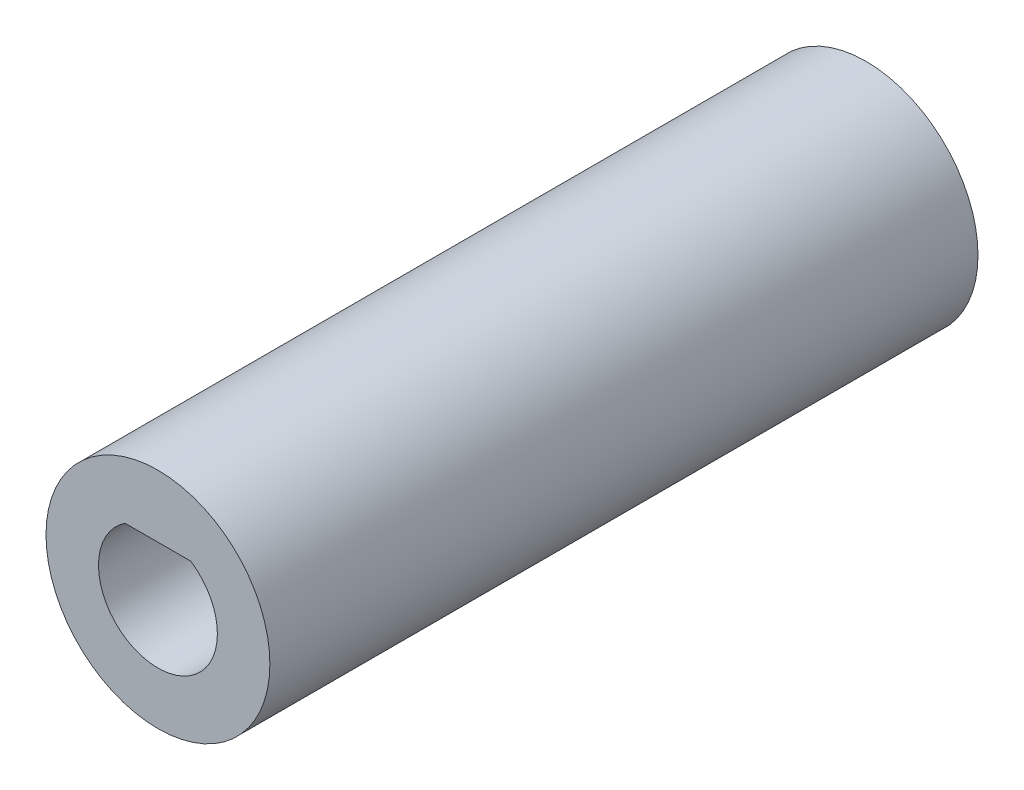
from build123d import *

# Parameters (mm, degrees)
SKETCH1_R           = 5.65
BOSS_EXTRUDE1_DEPTH = 7
SKETCH2_R           = 5.65
BOSS_EXTRUDE2_DEPTH = 14.74
SKETCH3_R           = 5.65
BOSS_EXTRUDE3_DEPTH = 14


with BuildPart() as part:
    # Sketch1 → Boss-Extrude1 (new body)
    # profile 1 of 12: a face of its own
    with BuildSketch(Plane.XY):
        Circle(SKETCH1_R)
        with BuildLine():
            ThreePointArc((-0.81964124, -3.557591308), (-1.028546403, -3.50290736), (-1.233852984, -3.435967766))
            ThreePointArc((-1.233852984, -3.435967766), (-1.973766094, -3.071239991), (-2.612905161, -2.549704746))
            ThreePointArc((-2.612905161, -2.549704746), (-2.759082994, -2.390759024), (-2.895607604, -2.223448736))
            ThreePointArc((-2.895607604, -2.223448736), (-3.320875399, -1.516592978), (-3.576590156, -0.732304943))
            ThreePointArc((-3.576590156, -0.732304943), (-3.613630229, -0.519561589), (-3.638027269, -0.305000442))
            ThreePointArc((-3.638027269, -0.305000442), (-3.613630229, 0.519561589), (-3.404733048, 1.317596505))
            ThreePointArc((-3.404733048, 1.317596505), (-3.320875399, 1.516592978), (-3.225398981, 1.710283337))
            ThreePointArc((-3.225398981, 1.710283337), (-2.759082994, 2.390759024), (-2.151897253, 2.949170373))
            ThreePointArc((-2.151897253, 2.949170373), (-1.973766094, 3.071239991), (-1.788729306, 3.182564241))
            ThreePointArc((-1.788729306, 3.182564241), (-1.028546403, 3.50290736), (-0.215849285, 3.644403485))
            ThreePointArc((-0.215849285, 3.644403485), (-0.107971873, 3.649193027), (0, 3.650790007))
            ThreePointArc((0, 3.650790007), (0.107971873, 3.649193027), (0.215849285, 3.644403485))
            ThreePointArc((0.215849285, 3.644403485), (1.028546403, 3.50290736), (1.788729306, 3.182564241))
            ThreePointArc((1.788729306, 3.182564241), (1.973766094, 3.071239991), (2.151897253, 2.949170373))
            ThreePointArc((2.151897253, 2.949170373), (2.759082994, 2.390759024), (3.225398981, 1.710283337))
            ThreePointArc((3.225398981, 1.710283337), (3.320875399, 1.516592978), (3.404733048, 1.317596505))
            ThreePointArc((3.404733048, 1.317596505), (3.588748603, 0.670187395), (3.650790007, 0))
            ThreePointArc((3.650790007, 0), (3.647597927, -0.152633677), (3.638027269, -0.305000442))
            ThreePointArc((3.638027269, -0.305000442), (3.613630229, -0.519561589), (3.576590156, -0.732304943))
            ThreePointArc((3.576590156, -0.732304943), (3.320875399, -1.516592978), (2.895607604, -2.223448736))
            ThreePointArc((2.895607604, -2.223448736), (2.759082994, -2.390759024), (2.612905161, -2.549704746))
            ThreePointArc((2.612905161, -2.549704746), (1.973766094, -3.071239991), (1.233852984, -3.435967766))
            ThreePointArc((1.233852984, -3.435967766), (1.028546403, -3.50290736), (0.81964124, -3.557591308))
            ThreePointArc((0.81964124, -3.557591308), (0, -3.650790007), (-0.81964124, -3.557591308))
        make_face(mode=Mode.SUBTRACT)
    # profile 2 of 12: a face of its own
    with BuildSketch(Plane.XY):
        with BuildLine():
            ThreePointArc((-2.151897253, 2.949170373), (-2.759082994, 2.390759024), (-3.225398981, 1.710283337))
            ThreePointArc((-3.225398981, 1.710283337), (-2.902782795, 1.721509121), (-2.585426091, 1.662416447))
            ThreePointArc((-2.585426091, 1.662416447), (-2.562741672, 1.6561643), (-2.539777266, 1.651035136))
            ThreePointArc((-2.539777266, 1.651035136), (-2.085465777, 1.807066382), (-1.99567797, 2.278959198))
            ThreePointArc((-1.99567797, 2.278959198), (-2.004023102, 2.300959902), (-2.013439941, 2.322523654))
            ThreePointArc((-2.013439941, 2.322523654), (-2.117095704, 2.628240359), (-2.151897253, 2.949170373))
        make_face()
    # profile 3 of 12: a face of its own
    with BuildSketch(Plane.XY):
        with BuildLine():
            ThreePointArc((-0.215849285, 3.644403485), (-1.028546403, 3.50290736), (-1.788729306, 3.182564241))
            ThreePointArc((-1.788729306, 3.182564241), (-1.511258183, 3.017588493), (-1.276228646, 2.796300584))
            ThreePointArc((-1.276228646, 2.796300584), (-1.260525464, 2.77877682), (-1.243979612, 2.762046398))
            ThreePointArc((-1.243979612, 2.762046398), (-0.777431606, 2.6476889), (-0.446772779, 2.996127445))
            ThreePointArc((-0.446772779, 2.996127445), (-0.441898672, 3.019147334), (-0.438162377, 3.042379044))
            ThreePointArc((-0.438162377, 3.042379044), (-0.360080224, 3.355604839), (-0.215849285, 3.644403485))
        make_face()
    # profile 4 of 12: a face of its own
    with BuildSketch(Plane.XY):
        with BuildLine():
            ThreePointArc((1.788729306, 3.182564241), (1.028546403, 3.50290736), (0.215849285, 3.644403485))
            ThreePointArc((0.215849285, 3.644403485), (0.360080224, 3.355604839), (0.438162377, 3.042379044))
            ThreePointArc((0.438162377, 3.042379044), (0.441898672, 3.019147334), (0.446772779, 2.996127445))
            ThreePointArc((0.446772779, 2.996127445), (0.777431606, 2.6476889), (1.243979612, 2.762046398))
            ThreePointArc((1.243979612, 2.762046398), (1.260525464, 2.77877682), (1.276228646, 2.796300584))
            ThreePointArc((1.276228646, 2.796300584), (1.511258183, 3.017588493), (1.788729306, 3.182564241))
        make_face()
    # profile 5 of 12: a face of its own
    with BuildSketch(Plane.XY):
        with BuildLine():
            ThreePointArc((2.585426091, 1.662416447), (2.902782795, 1.721509121), (3.225398981, 1.710283337))
            ThreePointArc((3.225398981, 1.710283337), (2.759082994, 2.390759024), (2.151897253, 2.949170373))
            ThreePointArc((2.151897253, 2.949170373), (2.117095704, 2.628240359), (2.013439941, 2.322523654))
            ThreePointArc((2.013439941, 2.322523654), (2.004023102, 2.300959902), (1.99567797, 2.278959198))
            ThreePointArc((1.99567797, 2.278959198), (2.085465777, 1.807066382), (2.539777266, 1.651035136))
            ThreePointArc((2.539777266, 1.651035136), (2.562741672, 1.6561643), (2.585426091, 1.662416447))
        make_face()
    # profile 6 of 12: a face of its own
    with BuildSketch(Plane.XY):
        with BuildLine():
            ThreePointArc((3.07376902, 0.000726834), (3.372694379, -0.121137234), (3.638027269, -0.305000442))
            ThreePointArc((3.638027269, -0.305000442), (3.647597927, -0.152633677), (3.650790007, 0))
            ThreePointArc((3.650790007, 0), (3.588748603, 0.670187395), (3.404733048, 1.317596505))
            ThreePointArc((3.404733048, 1.317596505), (3.201948257, 1.066428135), (2.94946455, 0.865283413))
            ThreePointArc((2.94946455, 0.865283413), (2.929884357, 0.852233959), (2.910969506, 0.838237507))
            ThreePointArc((2.910969506, 0.838237507), (2.731379298, 0.392713056), (3.029213584, 0.015831883))
            ThreePointArc((3.029213584, 0.015831883), (3.051305506, 0.007731316), (3.07376902, 0.000726834))
        make_face()
    # profile 7 of 12: a face of its own
    with BuildSketch(Plane.XY):
        with BuildLine():
            ThreePointArc((2.586212003, -1.661193544), (2.771799329, -1.925323372), (2.895607604, -2.223448736))
            ThreePointArc((2.895607604, -2.223448736), (3.320875399, -1.516592978), (3.576590156, -0.732304943))
            ThreePointArc((3.576590156, -0.732304943), (3.270204862, -0.833967486), (2.949055004, -0.866678197))
            ThreePointArc((2.949055004, -0.866678197), (2.92552803, -0.867070245), (2.902048792, -0.868618669))
            ThreePointArc((2.902048792, -0.868618669), (2.510099192, -1.146323891), (2.556895991, -1.62439788))
            ThreePointArc((2.556895991, -1.62439788), (2.571101401, -1.643156306), (2.586212003, -1.661193544))
        make_face()
    # profile 8 of 12: a face of its own
    with BuildSketch(Plane.XY):
        with BuildLine():
            ThreePointArc((1.277550948, -2.79569671), (1.290877576, -3.118232944), (1.233852984, -3.435967766))
            ThreePointArc((1.233852984, -3.435967766), (1.973766094, -3.071239991), (2.612905161, -2.549704746))
            ThreePointArc((2.612905161, -2.549704746), (2.300194531, -2.469584323), (2.012341335, -2.323475602))
            ThreePointArc((2.012341335, -2.323475602), (1.992337228, -2.311085771), (1.971748095, -2.299694554))
            ThreePointArc((1.971748095, -2.299694554), (1.491880328, -2.321411101), (1.272781988, -2.748892795))
            ThreePointArc((1.272781988, -2.748892795), (1.274590768, -2.772353412), (1.277550948, -2.79569671))
        make_face()
    # profile 9 of 12: a face of its own
    with BuildSketch(Plane.XY):
        with BuildLine():
            ThreePointArc((-0.436723505, -3.042585922), (-0.599888686, -3.321125588), (-0.81964124, -3.557591308))
            ThreePointArc((-0.81964124, -3.557591308), (0, -3.650790007), (0.81964124, -3.557591308))
            ThreePointArc((0.81964124, -3.557591308), (0.599888686, -3.321125588), (0.436723505, -3.042585922))
            ThreePointArc((0.436723505, -3.042585922), (0.426593428, -3.021347897), (0.415431304, -3.00063367))
            ThreePointArc((0.415431304, -3.00063367), (0, -2.75946669), (-0.415431304, -3.000633669))
            ThreePointArc((-0.415431304, -3.000633669), (-0.426593428, -3.021347896), (-0.436723505, -3.042585922))
        make_face()
    # profile 10 of 12: a face of its own
    with BuildSketch(Plane.XY):
        with BuildLine():
            ThreePointArc((-1.233852984, -3.435967766), (-1.290877576, -3.118232944), (-1.277550949, -2.79569671))
            ThreePointArc((-1.277550949, -2.79569671), (-1.274590768, -2.772353411), (-1.272781988, -2.748892794))
            ThreePointArc((-1.272781988, -2.748892794), (-1.491880327, -2.321411102), (-1.971748091, -2.299694555))
            ThreePointArc((-1.971748091, -2.299694555), (-1.992337225, -2.311085772), (-2.012341332, -2.323475603))
            ThreePointArc((-2.012341332, -2.323475603), (-2.300194529, -2.469584324), (-2.612905161, -2.549704746))
            ThreePointArc((-2.612905161, -2.549704746), (-1.973766094, -3.071239991), (-1.233852984, -3.435967766))
        make_face()
    # profile 11 of 12: a face of its own
    with BuildSketch(Plane.XY):
        with BuildLine():
            ThreePointArc((-3.576590156, -0.732304943), (-3.320875399, -1.516592978), (-2.895607604, -2.223448736))
            ThreePointArc((-2.895607604, -2.223448736), (-2.771799329, -1.925323372), (-2.586212003, -1.661193544))
            ThreePointArc((-2.586212003, -1.661193544), (-2.571101401, -1.643156306), (-2.556895991, -1.62439788))
            ThreePointArc((-2.556895991, -1.62439788), (-2.510099192, -1.146323891), (-2.902048792, -0.868618669))
            ThreePointArc((-2.902048792, -0.868618669), (-2.92552803, -0.867070245), (-2.949055004, -0.866678197))
            ThreePointArc((-2.949055004, -0.866678197), (-3.270204862, -0.833967486), (-3.576590156, -0.732304943))
        make_face()
    # profile 12 of 12: a face of its own
    with BuildSketch(Plane.XY):
        with BuildLine():
            ThreePointArc((-3.404733048, 1.317596505), (-3.613630229, 0.519561589), (-3.638027269, -0.305000442))
            ThreePointArc((-3.638027269, -0.305000442), (-3.372694379, -0.121137234), (-3.07376902, 0.000726834))
            ThreePointArc((-3.07376902, 0.000726834), (-3.051305506, 0.007731316), (-3.029213584, 0.015831883))
            ThreePointArc((-3.029213584, 0.015831883), (-2.731379298, 0.392713056), (-2.910969506, 0.838237507))
            ThreePointArc((-2.910969506, 0.838237507), (-2.929884357, 0.852233959), (-2.94946455, 0.865283413))
            ThreePointArc((-2.94946455, 0.865283413), (-3.201948257, 1.066428135), (-3.404733048, 1.317596505))
        make_face()
    extrude(amount=BOSS_EXTRUDE1_DEPTH)

    # Sketch2 → Boss-Extrude2 (add)
    with BuildSketch(Plane.XY.offset(7)):
        Circle(SKETCH2_R)
    extrude(amount=BOSS_EXTRUDE2_DEPTH)

    # Sketch3 → Boss-Extrude3 (add)
    with BuildSketch(Plane.XY.offset(21.74)):
        Circle(SKETCH3_R)
        with BuildLine():
            Line((-1.658312395, 2.5), (1.658312395, 2.5))
            ThreePointArc((1.658312395, 2.5), (0, -3), (-1.658312395, 2.5))
        make_face(mode=Mode.SUBTRACT)
    extrude(amount=BOSS_EXTRUDE3_DEPTH)


solid = part.part
